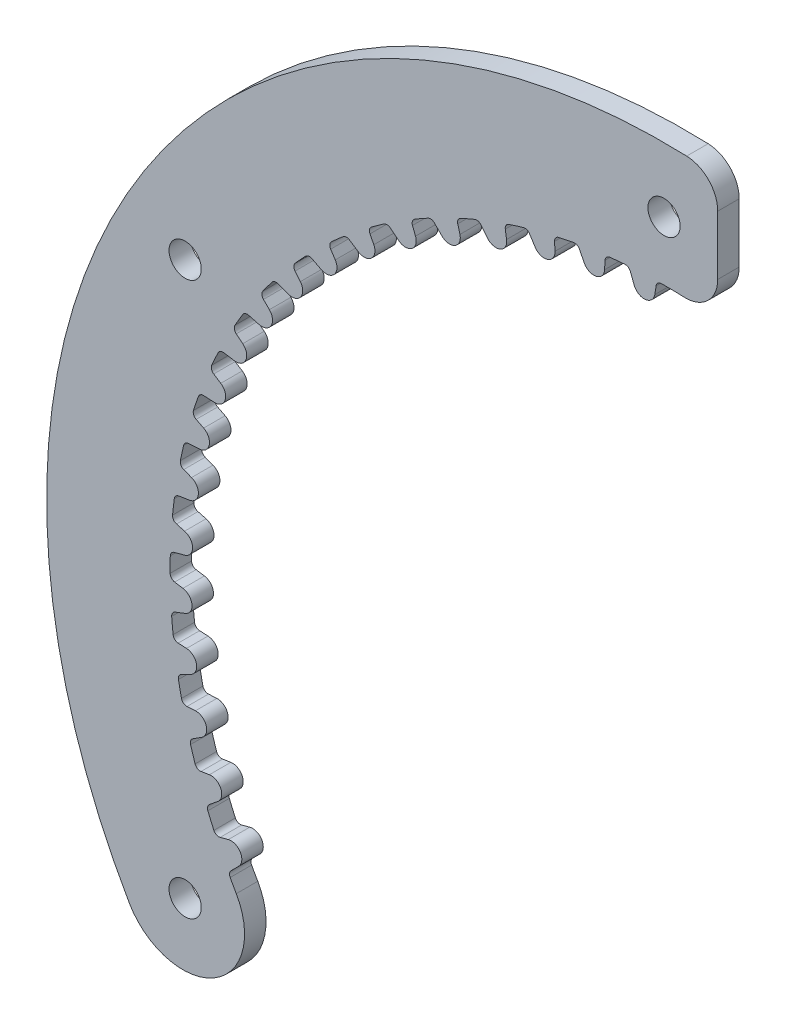
from build123d import *

# Parameters (mm, degrees)
SKETCH_1_R          = 3
EXTRUDE_1_DEPTH     = 2
FILLET_1_R          = 2
SKETCH_2_R          = 1.5
CUT_EXTRUDE_1_DEPTH = 10
CUT_EXTRUDE_START   = -10
SKETCH_3_R          = 108.407607876
CUT_EXTRUDE_2_DEPTH = 10


with BuildPart() as part:
    # 草图1 → 凸台-拉伸1 (new body)
    with BuildSketch(Plane.XY):
        with BuildLine():
            Line((0, 57.5), (6, 67.892304845))
            ThreePointArc((6, 67.892304845), (20.905960044, 81.110184977), (16.911920088, 61.592304845))
            Line((16.911920088, 61.592304845), (6.915077614, 45.477265766))
            ThreePointArc((6.915077614, 45.477265766), (5.741141936, 45.640325254), (4.563394983, 45.773086265))
            ThreePointArc((4.563394983, 45.773086265), (4.229488065, 45.686856477), (4.030829951, 45.404962241))
            Line((4.030829951, 45.404962241), (3.828548462, 44.650037449))
            ThreePointArc((3.828548462, 44.650037449), (2.862622636, 43.908856495), (1.89669681, 44.650037449))
            Line((1.89669681, 44.650037449), (1.638205167, 45.614741393))
            ThreePointArc((1.638205167, 45.614741393), (1.46463464, 45.878112154), (1.167937224, 45.985170682))
            ThreePointArc((1.167937224, 45.985170682), (0.460926002, 45.997690673), (-0.246194138, 45.999341174))
            ThreePointArc((-0.246194138, 45.999341174), (-0.569258412, 45.878680985), (-0.737362285, 45.577565568))
            Line((-0.737362285, 45.577565568), (-0.859624526, 44.80563216))
            ThreePointArc((-0.859624526, 44.80563216), (-1.742784404, 43.967544729), (-2.780893293, 44.603698675))
            Line((-2.780893293, 44.603698675), (-3.138807912, 45.536098135))
            ThreePointArc((-3.138807912, 45.536098135), (-3.338957342, 45.779883063), (-3.645220083, 45.855341789))
            ThreePointArc((-3.645220083, 45.855341789), (-4.349666918, 45.793890397), (-5.053085905, 45.721617675))
            ThreePointArc((-5.053085905, 45.721617675), (-5.361767975, 45.567849063), (-5.497475826, 45.250811548))
            Line((-5.497475826, 45.250811548), (-5.538379289, 44.470326988))
            ThreePointArc((-5.538379289, 44.470326988), (-6.329097132, 43.544515343), (-7.428015347, 44.068672444))
            Line((-7.428015347, 44.068672444), (-7.881431555, 44.958551858))
            ThreePointArc((-7.881431555, 44.958551858), (-8.10596701, 45.180079994), (-8.418439596, 45.223112175))
            ThreePointArc((-8.418439596, 45.223112175), (-9.112603978, 45.088362675), (-9.804615006, 44.942958565))
            ThreePointArc((-9.804615006, 44.942958565), (-10.095532886, 44.757766251), (-10.197357871, 44.428280168))
            Line((-10.197357871, 44.428280168), (-10.156454408, 43.647795608))
            ThreePointArc((-10.156454408, 43.647795608), (-10.846066949, 42.644403135), (-11.993754511, 43.050820616))
            Line((-11.993754511, 43.050820616), (-12.537704585, 43.888430278))
            ThreePointArc((-12.537704585, 43.888430278), (-12.784166007, 44.085274514), (-13.099424923, 44.09540868))
            ThreePointArc((-13.099424923, 44.09540868), (-13.775701442, 43.888837417), (-14.448722692, 43.671894996))
            ThreePointArc((-14.448722692, 43.671894996), (-14.718689026, 43.457307986), (-14.785515529, 43.118983253))
            Line((-14.785515529, 43.118983253), (-14.663253288, 42.347049845))
            ThreePointArc((-14.663253288, 42.347049845), (-15.244204986, 41.277069922), (-16.42808759, 41.561294989))
            Line((-16.42808759, 41.561294989), (-17.0566119, 42.337457871))
            ThreePointArc((-17.0566119, 42.337457871), (-17.322299005, 42.50746154), (-17.636890209, 42.484586661))
            ThreePointArc((-17.636890209, 42.484586661), (-18.287869438, 42.208456871), (-18.93452715, 41.922353007))
            ThreePointArc((-18.93452715, 41.922353007), (-19.180584129, 41.68072236), (-19.211679985, 41.337265734))
            Line((-19.211679985, 41.337265734), (-19.009398497, 40.582340942))
            ThreePointArc((-19.009398497, 40.582340942), (-19.475324323, 39.457496493), (-20.682431104, 39.616415116))
            Line((-20.682431104, 39.616415116), (-21.388643405, 40.322627417))
            ThreePointArc((-21.388643405, 40.322627417), (-21.670645271, 40.463927923), (-21.981122035, 40.40829462))
            ThreePointArc((-21.981122035, 40.40829462), (-22.599671709, 40.065631639), (-23.212880965, 39.713500945))
            ThreePointArc((-23.212880965, 39.713500945), (-23.432332739, 39.447474019), (-23.427357255, 39.102648482))
            Line((-23.427357255, 39.102648482), (-23.147272757, 38.37300342))
            ThreePointArc((-23.147272757, 38.37300342), (-23.493067932, 37.205618476), (-24.710173575, 37.237489509))
            Line((-24.710173575, 37.237489509), (-25.486336457, 37.866013818))
            ThreePointArc((-25.486336457, 37.866013818), (-25.781563412, 37.977063044), (-26.084524089, 37.889280847))
            ThreePointArc((-26.084524089, 37.889280847), (-26.663867248, 37.483838963), (-27.236909599, 37.069539456))
            ThreePointArc((-27.236909599, 37.069539456), (-27.427351807, 36.782030896), (-27.386359496, 36.43961443))
            Line((-27.386359496, 36.43961443), (-27.031540654, 35.743243242))
            ThreePointArc((-27.031540654, 35.743243242), (-27.253416571, 34.546107917), (-28.467186213, 34.450582174))
            Line((-28.467186213, 34.450582174), (-29.304795874, 34.994532248))
            ThreePointArc((-29.304795874, 34.994532248), (-29.61001335, 35.074113515), (-29.902138638, 34.955144184))
            ThreePointArc((-29.902138638, 34.955144184), (-30.435927877, 34.491365503), (-30.962524952, 34.019436336))
            ThreePointArc((-30.962524952, 34.019436336), (-31.12187107, 33.713596147), (-31.045311052, 33.377340336))
            Line((-31.045311052, 33.377340336), (-30.619645334, 32.721872611))
            ThreePointArc((-30.619645334, 32.721872611), (-30.715171076, 31.50810297), (-31.912306402, 31.286227052))
            Line((-31.912306402, 31.286227052), (-32.802185815, 31.73964326))
            ThreePointArc((-32.802185815, 31.73964326), (-33.114049785, 31.786884658), (-33.392139098, 31.638031646))
            ThreePointArc((-33.392139098, 31.638031646), (-33.874526112, 31.120997424), (-34.348908402, 30.596609152))
            ThreePointArc((-34.348908402, 30.596609152), (-34.4754126, 30.275788183), (-34.364123683, 29.949377118))
            Line((-34.364123683, 29.949377118), (-33.872274772, 29.341994297))
            ThreePointArc((-33.872274772, 29.341994297), (-33.840403739, 28.124888653), (-35.007788683, 27.779093479))
            Line((-35.007788683, 27.779093479), (-35.940188143, 28.137008098))
            ThreePointArc((-35.940188143, 28.137008098), (-36.255281761, 28.151392042), (-36.516288295, 27.974286213))
            ThreePointArc((-36.516288295, 27.974286213), (-36.94198795, 27.409661186), (-37.358958024, 26.838559115))
            ThreePointArc((-37.358958024, 26.838559115), (-37.451234295, 26.506272348), (-37.306435784, 26.193282256))
            Line((-37.306435784, 26.193282256), (-36.75379248, 25.640638953))
            ThreePointArc((-36.75379248, 25.640638953), (-36.594873857, 24.433532171), (-37.719718306, 23.967606345))
            Line((-37.719718306, 23.967606345), (-38.68442225, 24.226097988))
            ThreePointArc((-38.68442225, 24.226097988), (-38.999293283, 24.207466883), (-39.240357396, 24.004048647))
            ThreePointArc((-39.240357396, 24.004048647), (-39.604705637, 23.398018964), (-39.959695083, 22.786460209))
            ThreePointArc((-39.959695083, 22.786460209), (-40.016732431, 22.446348246), (-39.840010767, 22.150208313))
            Line((-39.840010767, 22.150208313), (-39.232627946, 21.658359402))
            ThreePointArc((-39.232627946, 21.658359402), (-38.948402879, 20.474476798), (-40.018382802, 19.8935251))
            Line((-40.018382802, 19.8935251), (-41.00482173, 20.049761678))
            ThreePointArc((-41.00482173, 20.049761678), (-41.316020386, 19.998319651), (-41.53450093, 19.7708177))
            ThreePointArc((-41.53450093, 19.7708177), (-41.833505881, 19.130023149), (-42.122625362, 18.484708076))
            ThreePointArc((-42.122625362, 18.484708076), (-42.143798872, 18.140497256), (-41.937090256, 17.864452052))
            Line((-41.937090256, 17.864452052), (-41.28162253, 17.438786334))
            ThreePointArc((-41.28162253, 17.438786334), (-40.875205049, 16.291098772), (-41.878597522, 15.601486232))
            Line((-41.878597522, 15.601486232), (-42.875963804, 15.653755984))
            ThreePointArc((-42.875963804, 15.653755984), (-43.180080525, 15.570066644), (-43.373583779, 15.320973537))
            ThreePointArc((-43.373583779, 15.320973537), (-43.603969481, 14.652434798), (-43.824051342, 13.980433613))
            ThreePointArc((-43.824051342, 13.980433613), (-43.809129033, 13.635895181), (-43.574698207, 13.382969116))
            Line((-43.574698207, 13.382969116), (-42.87832702, 13.028150274))
            ThreePointArc((-42.87832702, 13.028150274), (-42.354169919, 11.929232059), (-43.279981563, 11.138514215))
            Line((-43.279981563, 11.138514215), (-44.277347845, 11.086244463))
            ThreePointArc((-44.277347845, 11.086244463), (-44.571050665, 10.971224729), (-44.737456569, 10.703269582))
            ThreePointArc((-44.737456569, 10.703269582), (-44.896698866, 10.014311305), (-45.045331844, 9.322986594))
            ThreePointArc((-45.045331844, 9.322986594), (-44.994477209, 8.981895386), (-44.734892647, 8.75485957))
            Line((-44.734892647, 8.75485957), (-44.005247585, 8.474775073))
            ThreePointArc((-44.005247585, 8.474775073), (-43.369093639, 7.436666183), (-44.20718107, 6.553506306))
            Line((-44.20718107, 6.553506306), (-45.193619998, 6.397269728))
            ThreePointArc((-45.193619998, 6.397269728), (-45.473691047, 6.25217978), (-45.611176422, 5.968298366))
            ThreePointArc((-45.611176422, 5.968298366), (-45.697530624, 5.266468921), (-45.773086265, 4.563394983))
            ThreePointArc((-45.773086265, 4.563394983), (-45.686856477, 4.229488065), (-45.404962241, 4.030829951))
            Line((-45.404962241, 4.030829951), (-44.650037449, 3.828548462))
            ThreePointArc((-44.650037449, 3.828548462), (-43.908856495, 2.862622636), (-44.650037449, 1.89669681))
            Line((-44.650037449, 1.89669681), (-45.614741393, 1.638205167))
            ThreePointArc((-45.614741393, 1.638205167), (-45.878112154, 1.46463464), (-45.985170682, 1.167937224))
            ThreePointArc((-45.985170682, 1.167937224), (-45.997690673, 0.460926002), (-45.999341174, -0.246194138))
            ThreePointArc((-45.999341174, -0.246194138), (-45.878680984, -0.569258412), (-45.577565568, -0.737362285))
            Line((-45.577565568, -0.737362285), (-44.80563216, -0.859624526))
            ThreePointArc((-44.80563216, -0.859624526), (-43.967544729, -1.742784404), (-44.603698675, -2.780893293))
            Line((-44.603698675, -2.780893293), (-45.536098135, -3.138807912))
            ThreePointArc((-45.536098135, -3.138807912), (-45.779883063, -3.338957342), (-45.855341789, -3.645220083))
            ThreePointArc((-45.855341789, -3.645220083), (-45.793890397, -4.349666918), (-45.721617675, -5.053085905))
            ThreePointArc((-45.721617675, -5.053085905), (-45.567849063, -5.361767975), (-45.250811548, -5.497475826))
            Line((-45.250811548, -5.497475826), (-44.470326988, -5.538379289))
            ThreePointArc((-44.470326988, -5.538379289), (-43.544515343, -6.329097132), (-44.068672444, -7.428015347))
            Line((-44.068672444, -7.428015347), (-44.958551858, -7.881431555))
            ThreePointArc((-44.958551858, -7.881431555), (-45.180079994, -8.10596701), (-45.223112175, -8.418439596))
            ThreePointArc((-45.223112175, -8.418439596), (-45.088362675, -9.112603978), (-44.942958565, -9.804615006))
            ThreePointArc((-44.942958565, -9.804615006), (-44.757766251, -10.095532886), (-44.428280168, -10.197357871))
            Line((-44.428280168, -10.197357871), (-43.647795608, -10.156454408))
            ThreePointArc((-43.647795608, -10.156454408), (-42.644403135, -10.846066949), (-43.050820616, -11.993754511))
            Line((-43.050820616, -11.993754511), (-43.888430278, -12.537704585))
            ThreePointArc((-43.888430278, -12.537704585), (-44.085274514, -12.784166007), (-44.09540868, -13.099424923))
            ThreePointArc((-44.09540868, -13.099424923), (-43.888837417, -13.775701442), (-43.671894996, -14.448722692))
            ThreePointArc((-43.671894996, -14.448722692), (-43.457307986, -14.718689026), (-43.118983253, -14.785515529))
            Line((-43.118983253, -14.785515529), (-42.347049845, -14.663253288))
            ThreePointArc((-42.347049845, -14.663253288), (-41.277069922, -15.244204986), (-41.561294989, -16.42808759))
            Line((-41.561294989, -16.42808759), (-42.337457871, -17.0566119))
            ThreePointArc((-42.337457871, -17.0566119), (-42.50746154, -17.322299005), (-42.484586661, -17.636890209))
            ThreePointArc((-42.484586661, -17.636890209), (-42.208456871, -18.287869438), (-41.922353007, -18.93452715))
            ThreePointArc((-41.922353007, -18.93452715), (-41.68072236, -19.180584129), (-41.337265734, -19.211679985))
            Line((-41.337265734, -19.211679985), (-40.582340942, -19.009398497))
            ThreePointArc((-40.582340942, -19.009398497), (-39.457496493, -19.475324323), (-39.616415116, -20.682431104))
            Line((-39.616415116, -20.682431104), (-40.322627417, -21.388643405))
            ThreePointArc((-40.322627417, -21.388643405), (-40.463927923, -21.670645271), (-40.40829462, -21.981122035))
            ThreePointArc((-40.40829462, -21.981122035), (-40.125965644, -22.492373844), (-39.837168574, -23))
            ThreePointArc((-39.837168574, -23), (-41.941814646, -30.854646072), (-49.796460718, -28.75))
            ThreePointArc((-49.796460718, -28.75), (-49.796460718, 28.75), (0, 57.5))
        make_face()
        with Locations((15.655960044, 72.016918237)):
            Circle(SKETCH_1_R, mode=Mode.SUBTRACT)
    extrude(amount=EXTRUDE_1_DEPTH)

    # 圆角1
    fillet_1_edges = [part.edges().sort_by_distance(p)[0] for p in [
        (6.915077614, 45.477265766, 1),
    ]]
    fillet(fillet_1_edges, radius=FILLET_1_R)

    # 草图2 → 切除-拉伸1 (cut)
    with BuildSketch(Plane.XY.offset(2)):
        with Locations((-44.600308295, 25.75)):
            Circle(SKETCH_2_R)
        with Locations((-44.600308295, -25.75)):
            Circle(SKETCH_2_R)
        with Locations((0, 51.5)):
            Circle(SKETCH_2_R)
    extrude(amount=-CUT_EXTRUDE_1_DEPTH, mode=Mode.SUBTRACT)

    # 草图3 → 切除-拉伸2 (cut)
    with BuildSketch(Plane.XY.offset(2).offset(CUT_EXTRUDE_START)):
        Circle(SKETCH_3_R)
        with BuildLine():
            ThreePointArc((1.87755102, 45.96166666), (0.815895926, 45.992763712), (-0.246194138, 45.999341174))
            Line((-0.246194138, 45.999341174), (-0.246194138, 41.16482451))
            ThreePointArc((-0.246194138, 41.16482451), (-41.165376659, -0.12309762), (0, -41.165560709))
            Line((0, -41.165560709), (-31.394412938, -60.623281718))
            Line((-31.394412938, -60.623281718), (-49.796460718, -28.75))
            ThreePointArc((-49.796460718, -28.75), (-49.796460718, 28.75), (0, 57.5))
            ThreePointArc((0, 57.5), (1.055223578, 57.490316604), (2.110091743, 57.461269677))
            ThreePointArc((2.110091743, 57.461269677), (4.159892964, 56.545323623), (5, 54.463290389))
            Line((5, 54.463290389), (5, 51.5))
            Line((5, 51.5), (5, 48.95916666))
            ThreePointArc((5, 48.95916666), (4.077577082, 46.79498703), (1.87755102, 45.96166666))
        make_face(mode=Mode.SUBTRACT)
    extrude(amount=CUT_EXTRUDE_2_DEPTH, mode=Mode.SUBTRACT)


solid = part.part
